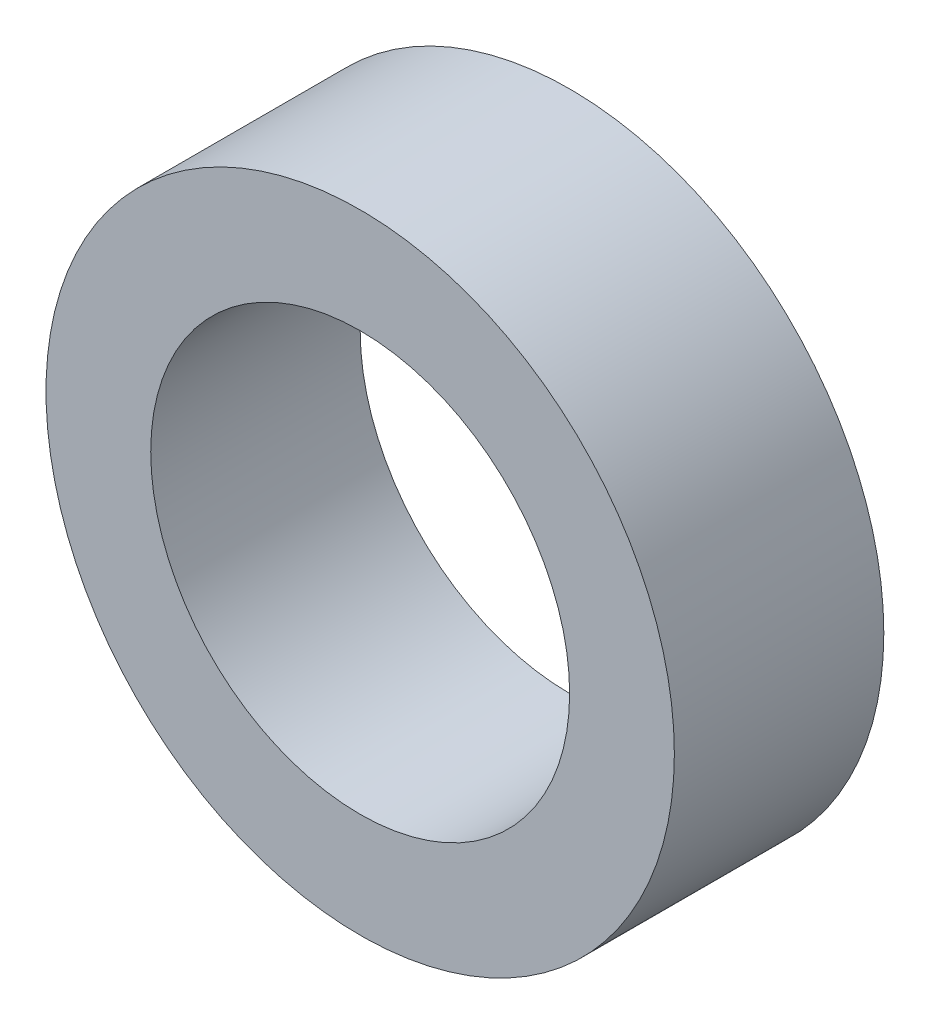
from build123d import *

# Parameters (mm, degrees)
SKETCH1_R           = 4.7625
SKETCH1_R_2         = 3.175
BOSS_EXTRUDE1_DEPTH = 3.175


with BuildPart() as part:
    # Sketch1 → Boss-Extrude1 (new body)
    with BuildSketch(Plane.XY):
        Circle(SKETCH1_R)
        Circle(SKETCH1_R_2, mode=Mode.SUBTRACT)
    extrude(amount=BOSS_EXTRUDE1_DEPTH)


solid = part.part
